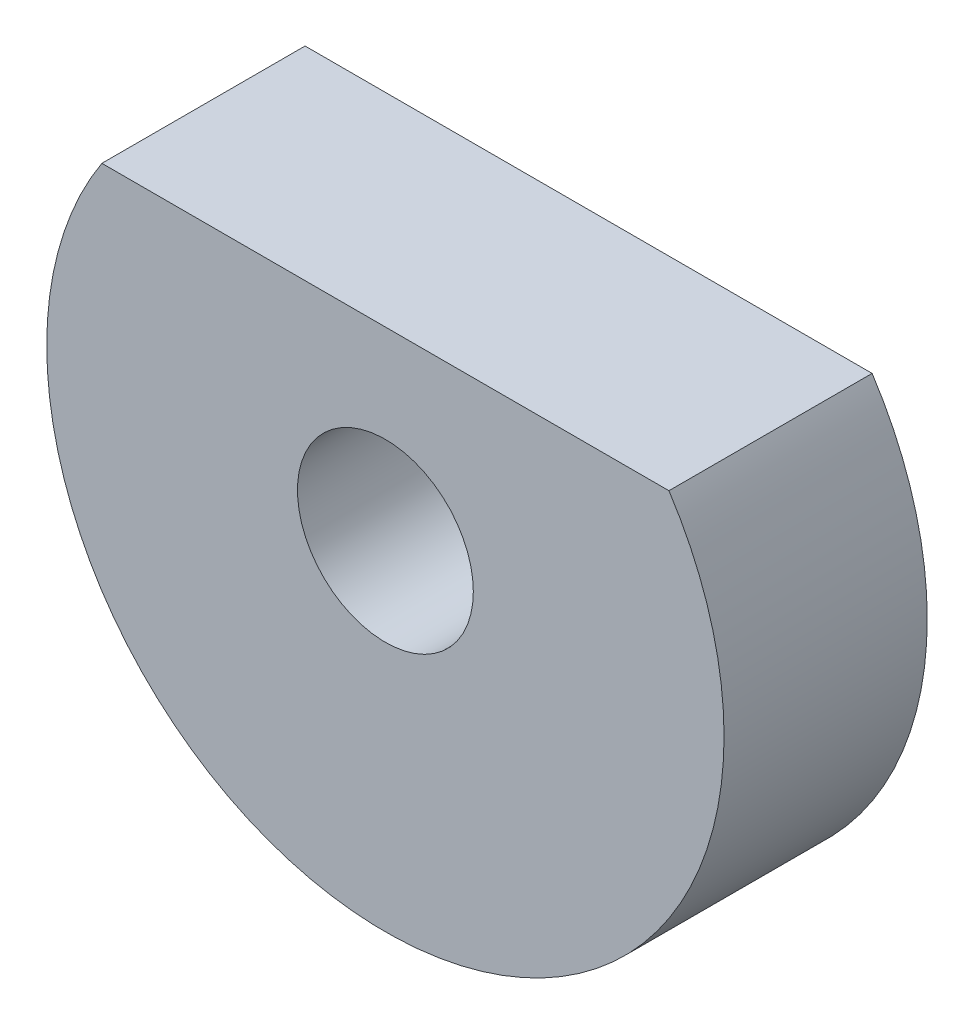
from build123d import *

# Parameters (mm, degrees)
SKETCH1_R           = 0.649141345
BOSS_EXTRUDE1_DEPTH = 1.5


with BuildPart() as part:
    # Sketch1 → Boss-Extrude1 (new body)
    with BuildSketch(Plane.XY):
        with BuildLine():
            Line((-2.093018544, 1.367213726), (2.093018544, 1.367213726))
            ThreePointArc((2.093018544, 1.367213726), (0, -2.5), (-2.093018544, 1.367213726))
        make_face()
        Circle(SKETCH1_R, mode=Mode.SUBTRACT)
    extrude(amount=BOSS_EXTRUDE1_DEPTH)


solid = part.part
